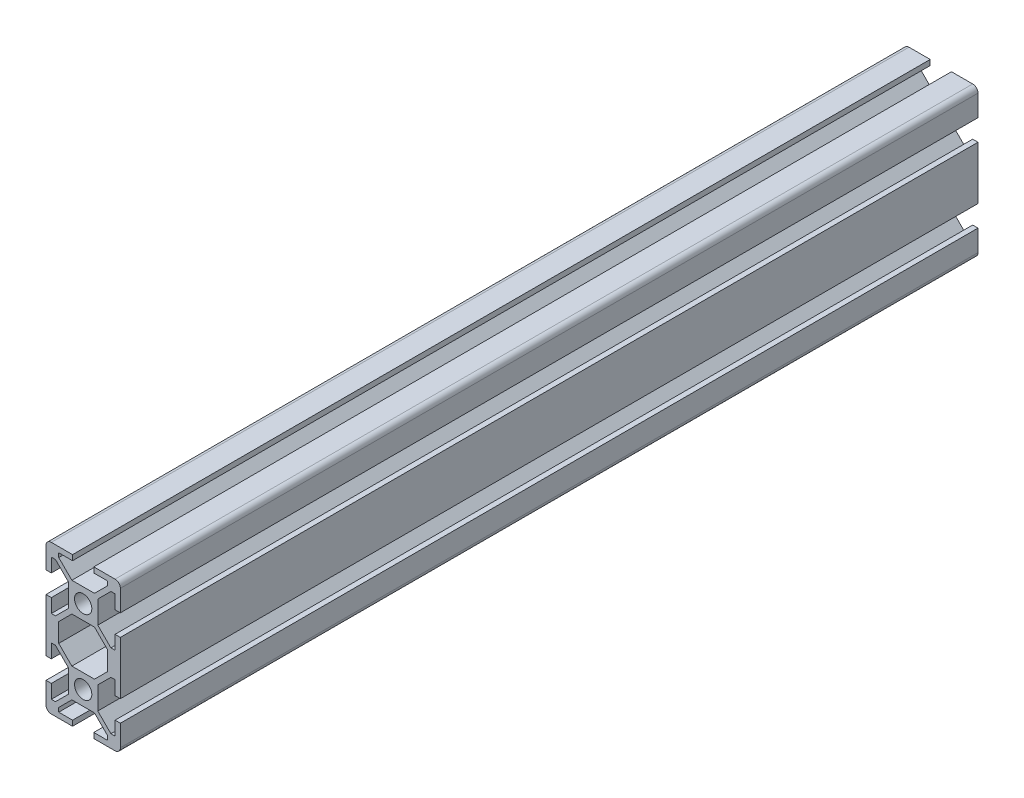
from build123d import *

# Parameters (mm, degrees)
EXTRUSION2_DEPTH           = 161.5
EXTRUSION2_DEPTH_BACK      = 161.5
SKETCH1_R                  = 3.25
F_4_7_4_7_DIAMETER_HOLE1_D = 4.75


with BuildPart() as part:
    # Sketch1 → Extrusion2 (new, two sides: drawn at the far end of the back side and taken through both)
    with BuildSketch(Plane.XY.offset(-EXTRUSION2_DEPTH_BACK)):
        with BuildLine():
            Line((-51.945456549, 19.536039976), (-51.945456549, -0.463960024))
            Line((-51.945456549, -0.463960024), (-49.945456549, -0.463960024))
            Line((-49.945456549, -0.463960024), (-49.945456549, 4.741263919))
            Line((-49.945456549, 4.741263919), (-48.386244669, 4.741263919))
            Line((-48.386244669, 4.741263919), (-43.445456549, -0.1995242))
            Line((-43.445456549, -0.1995242), (-43.445456549, -8.717947961))
            Line((-43.445456549, -8.717947961), (-48.386244669, -13.658736081))
            Line((-48.386244669, -13.658736081), (-49.945456549, -13.658736081))
            Line((-49.945456549, -13.658736081), (-49.945456549, -8.458736081))
            Line((-49.945456549, -8.458736081), (-51.945456549, -8.458736081))
            Line((-51.945456549, -8.458736081), (-51.945456549, -16.458736081))
            ThreePointArc((-51.945456549, -16.458736081), (-51.359670111, -17.872949643), (-49.945456549, -18.458736081))
            Line((-49.945456549, -18.458736081), (-41.945456549, -18.458736081))
            Line((-41.945456549, -18.458736081), (-41.945456549, -16.458736081))
            Line((-41.945456549, -16.458736081), (-47.145456549, -16.458736081))
            Line((-47.145456549, -16.458736081), (-47.145456549, -14.8995242))
            Line((-47.145456549, -14.8995242), (-42.204668429, -9.958736081))
            Line((-42.204668429, -9.958736081), (-33.686244669, -9.958736081))
            Line((-33.686244669, -9.958736081), (-28.745456549, -14.8995242))
            Line((-28.745456549, -14.8995242), (-28.745456549, -16.458736081))
            Line((-28.745456549, -16.458736081), (-33.945456549, -16.458736081))
            Line((-33.945456549, -16.458736081), (-33.945456549, -18.458736081))
            Line((-33.945456549, -18.458736081), (-25.945456549, -18.458736081))
            ThreePointArc((-25.945456549, -18.458736081), (-24.531242987, -17.872949643), (-23.945456549, -16.458736081))
            Line((-23.945456549, -16.458736081), (-23.945456549, -8.458736081))
            Line((-23.945456549, -8.458736081), (-25.945456549, -8.458736081))
            Line((-25.945456549, -8.458736081), (-25.945456549, -13.658736081))
            Line((-25.945456549, -13.658736081), (-27.504668429, -13.658736081))
            Line((-27.504668429, -13.658736081), (-32.445456549, -8.717947961))
            Line((-32.445456549, -8.717947961), (-32.445456549, -0.1995242))
            Line((-32.445456549, -0.1995242), (-27.504668429, 4.741263919))
            Line((-27.504668429, 4.741263919), (-25.945456549, 4.741263919))
            Line((-25.945456549, 4.741263919), (-25.945456549, -0.463960024))
            Line((-25.945456549, -0.463960024), (-23.945456549, -0.463960024))
            Line((-23.945456549, -0.463960024), (-23.945456549, 19.541263919))
            Line((-23.945456549, 19.541263919), (-25.945456549, 19.541263919))
            Line((-25.945456549, 19.541263919), (-25.945456549, 14.341263919))
            Line((-25.945456549, 14.341263919), (-27.504668429, 14.341263919))
            Line((-27.504668429, 14.341263919), (-32.445456549, 19.282052039))
            Line((-32.445456549, 19.282052039), (-32.445456549, 27.8004758))
            Line((-32.445456549, 27.8004758), (-27.504668429, 32.741263919))
            Line((-27.504668429, 32.741263919), (-25.945456549, 32.741263919))
            Line((-25.945456549, 32.741263919), (-25.945456549, 27.541263919))
            Line((-25.945456549, 27.541263919), (-23.945456549, 27.541263919))
            Line((-23.945456549, 27.541263919), (-23.945456549, 35.541263919))
            ThreePointArc((-23.945456549, 35.541263919), (-24.531242987, 36.955477482), (-25.945456549, 37.541263919))
            Line((-25.945456549, 37.541263919), (-33.945456549, 37.541263919))
            Line((-33.945456549, 37.541263919), (-33.945456549, 35.541263919))
            Line((-33.945456549, 35.541263919), (-28.745456549, 35.541263919))
            Line((-28.745456549, 35.541263919), (-28.745456549, 33.982052039))
            Line((-28.745456549, 33.982052039), (-33.686244669, 29.041263919))
            Line((-33.686244669, 29.041263919), (-42.204668429, 29.041263919))
            Line((-42.204668429, 29.041263919), (-47.145456549, 33.982052039))
            Line((-47.145456549, 33.982052039), (-47.145456549, 35.541263919))
            Line((-47.145456549, 35.541263919), (-41.945456549, 35.541263919))
            Line((-41.945456549, 35.541263919), (-41.945456549, 37.541263919))
            Line((-41.945456549, 37.541263919), (-49.945456549, 37.541263919))
            ThreePointArc((-49.945456549, 37.541263919), (-51.359670111, 36.955477482), (-51.945456549, 35.541263919))
            Line((-51.945456549, 35.541263919), (-51.945456549, 27.541263919))
            Line((-51.945456549, 27.541263919), (-49.945456549, 27.541263919))
            Line((-49.945456549, 27.541263919), (-49.945456549, 32.736039976))
            Line((-49.945456549, 32.736039976), (-48.372120999, 32.736039976))
            Line((-48.372120999, 32.736039976), (-43.43133288, 27.795251856))
            Line((-43.43133288, 27.795251856), (-43.43133288, 19.276828096))
            Line((-43.43133288, 19.276828096), (-48.372120999, 14.336039976))
            Line((-48.372120999, 14.336039976), (-49.93133288, 14.336039976))
            Line((-49.93133288, 14.336039976), (-49.93133288, 19.536039976))
            Line((-49.93133288, 19.536039976), (-51.945456549, 19.536039976))
        make_face()
        with Locations((-37.945456549, -4.458736081)):
            Circle(SKETCH1_R, mode=Mode.SUBTRACT)
        with Locations((-37.945456549, 23.541263919)):
            Circle(SKETCH1_R, mode=Mode.SUBTRACT)
        Polygon((-33.686244669, 18.041263919), (-42.204668429, 18.041263919), (-47.145456549, 13.1004758), (-47.145456549, 5.982052039), (-42.204668429, 1.041263919), (-33.686244669, 1.041263919), (-28.745456549, 5.982052039), (-28.745456549, 13.1004758), align=None, mode=Mode.SUBTRACT)
    extrude(amount=EXTRUSION2_DEPTH + EXTRUSION2_DEPTH_BACK)

    # Ø4.7 (4.7) Diameter Hole1 (through all)
    with Locations(Plane(origin=(-23.945456549, 0, 0), x_dir=(0, 0, -1), z_dir=(1, 0, 0))):
        with Locations((-140.5, 23.541263919), (140.5, 23.541263919)):
            Hole(F_4_7_4_7_DIAMETER_HOLE1_D / 2)


solid = part.part
